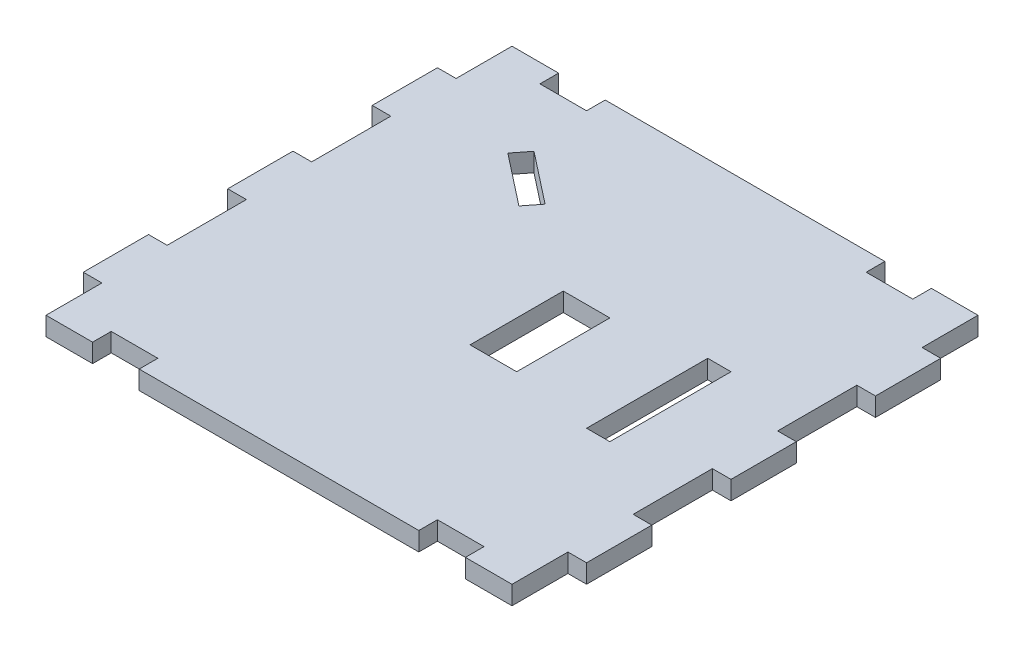
from build123d import *

# Parameters (mm, degrees)
SKETCH1_W           = 50
SKETCH1_H           = 50
SKETCH1_W_2         = 2.5
SKETCH1_H_2         = 13
SKETCH1_W_3         = 2
SKETCH1_H_3         = 7
BOSS_EXTRUDE1_DEPTH = 2
SKETCH3_W           = 5
SKETCH3_H           = 2
CUT_EXTRUDE1_DEPTH  = 2
SKETCH4_W           = 5
SKETCH4_H           = 10
CUT_EXTRUDE2_DEPTH  = 2
CUT_EXTRUDE3_DEPTH  = 2


with BuildPart() as part:
    # Sketch1 → Boss-Extrude1 (new body)
    # profile 1 of 7: a face of its own
    with BuildSketch(Plane(origin=(0, 0, 0), x_dir=(1, 0, 0), z_dir=(0, 1, 0))):
        Rectangle(SKETCH1_W, SKETCH1_H)
        with Locations((15.75, 0)):
            Rectangle(SKETCH1_W_2, SKETCH1_H_2, mode=Mode.SUBTRACT)
    # profile 2 of 7: a face of its own
    with BuildSketch(Plane(origin=(0, 0, 0), x_dir=(1, 0, 0), z_dir=(0, 1, 0))):
        with Locations((26, 0)):
            Rectangle(SKETCH1_W_3, SKETCH1_H_3)
    # profile 3 of 7: a face of its own
    with BuildSketch(Plane(origin=(0, 0, 0), x_dir=(1, 0, 0), z_dir=(0, 1, 0))):
        with Locations((26, 15.5)):
            Rectangle(SKETCH1_W_3, SKETCH1_H_3)
    # profile 4 of 7: a face of its own
    with BuildSketch(Plane(origin=(0, 0, 0), x_dir=(1, 0, 0), z_dir=(0, 1, 0))):
        with Locations((26, -15.5)):
            Rectangle(SKETCH1_W_3, SKETCH1_H_3)
    # profile 5 of 7: a face of its own
    with BuildSketch(Plane(origin=(0, 0, 0), x_dir=(1, 0, 0), z_dir=(0, 1, 0))):
        with Locations((-26, 0)):
            Rectangle(SKETCH1_W_3, SKETCH1_H_3)
    # profile 6 of 7: a face of its own
    with BuildSketch(Plane(origin=(0, 0, 0), x_dir=(1, 0, 0), z_dir=(0, 1, 0))):
        with Locations((-26, -15.5)):
            Rectangle(SKETCH1_W_3, SKETCH1_H_3)
    # profile 7 of 7: a face of its own
    with BuildSketch(Plane(origin=(0, 0, 0), x_dir=(1, 0, 0), z_dir=(0, 1, 0))):
        with Locations((-26, 15.5)):
            Rectangle(SKETCH1_W_3, SKETCH1_H_3)
    extrude(amount=BOSS_EXTRUDE1_DEPTH)

    # Sketch3 → Cut-Extrude1 (cut)
    with BuildSketch(Plane(origin=(0, 2, 0), x_dir=(1, 0, 0), z_dir=(0, 1, 0))):
        with Locations((17.5, 24)):
            Rectangle(SKETCH3_W, SKETCH3_H)
        with Locations((17.5, -24)):
            Rectangle(SKETCH3_W, SKETCH3_H)
        with Locations((-17.5, 24)):
            Rectangle(SKETCH3_W, SKETCH3_H)
        with Locations((-17.5, -24)):
            Rectangle(SKETCH3_W, SKETCH3_H)
    extrude(amount=-CUT_EXTRUDE1_DEPTH, mode=Mode.SUBTRACT)

    # Sketch4 → Cut-Extrude2 (cut)
    with BuildSketch(Plane(origin=(0, 2, 0), x_dir=(1, 0, 0), z_dir=(0, 1, 0))):
        with Locations((3, 0)):
            Rectangle(SKETCH4_W, SKETCH4_H)
    extrude(amount=-CUT_EXTRUDE2_DEPTH, mode=Mode.SUBTRACT)

    # Sketch5 → Cut-Extrude3 (cut)
    with BuildSketch(Plane(origin=(0, 2, 0), x_dir=(1, 0, 0), z_dir=(0, 1, 0))):
        Polygon((-14.056788221, 16.417088801), (-8.5488143, 12.097109255), (-9.78309417, 10.52340242), (-15.291068091, 14.843381966), align=None)
    extrude(amount=-CUT_EXTRUDE3_DEPTH, mode=Mode.SUBTRACT)


solid = part.part
